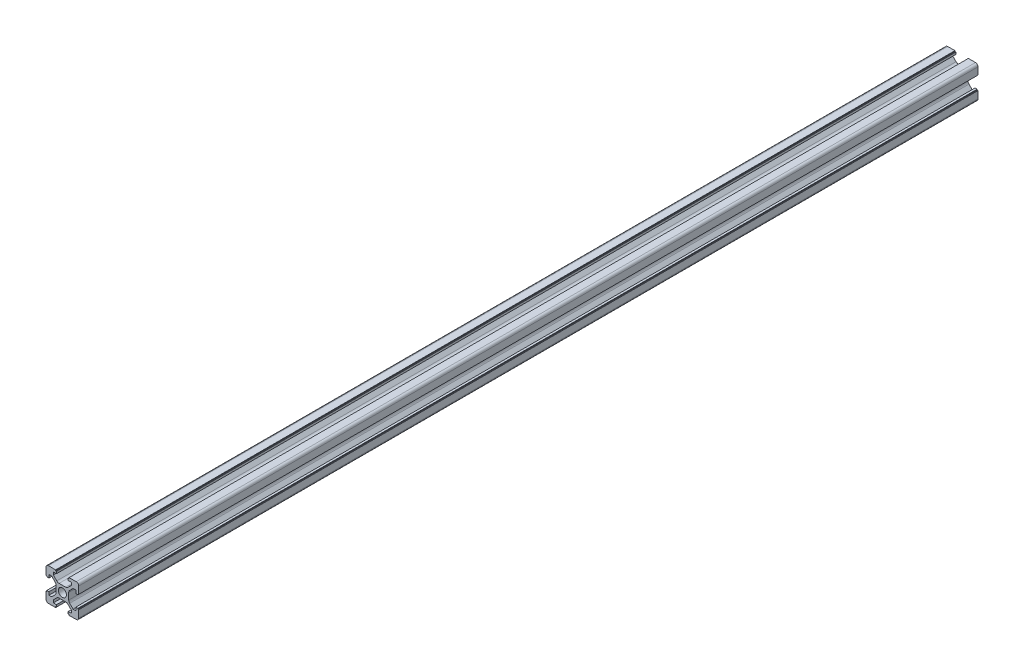
from build123d import *

# Parameters (mm, degrees)
SKETCH1_R           = 2.5
BOSS_EXTRUDE2_DEPTH = 550


with BuildPart() as part:
    # Sketch1 → Boss-Extrude2 (new body)
    with BuildSketch(Plane.XY):
        with BuildLine():
            Line((10, -4.1), (10, -8.5))
            ThreePointArc((10, -8.5), (9.560660172, -9.560660172), (8.5, -10))
            Line((8.5, -10), (4.1, -10))
            Line((4.1, -10), (4.1, -9.5))
            Line((4.1, -9.5), (3.6, -9.5))
            Line((3.6, -9.5), (3.6, -8.2))
            Line((3.6, -8.2), (5.5, -8.2))
            Line((5.5, -8.2), (5.5, -6.560660172))
            Line((5.5, -6.560660172), (3.425126266, -4.485786438))
            ThreePointArc((3.425126266, -4.485786438), (2.776279568, -4.052240935), (2.010912703, -3.9))
            Line((2.010912703, -3.9), (-2.010912703, -3.9))
            ThreePointArc((-2.010912703, -3.9), (-2.776279568, -4.052240935), (-3.425126266, -4.485786438))
            Line((-3.425126266, -4.485786438), (-5.5, -6.560660172))
            Line((-5.5, -6.560660172), (-5.5, -8.2))
            Line((-5.5, -8.2), (-3.6, -8.2))
            Line((-3.6, -8.2), (-3.6, -9.5))
            Line((-3.6, -9.5), (-4.1, -9.5))
            Line((-4.1, -9.5), (-4.1, -10))
            Line((-4.1, -10), (-8.5, -10))
            ThreePointArc((-8.5, -10), (-9.560660172, -9.560660172), (-10, -8.5))
            Line((-10, -8.5), (-10, -4.1))
            Line((-10, -4.1), (-9.5, -4.1))
            Line((-9.5, -4.1), (-9.5, -3.6))
            Line((-9.5, -3.6), (-8.2, -3.6))
            Line((-8.2, -3.6), (-8.2, -5.5))
            Line((-8.2, -5.5), (-6.560660172, -5.5))
            Line((-6.560660172, -5.5), (-4.485786438, -3.425126266))
            ThreePointArc((-4.485786438, -3.425126266), (-4.052240935, -2.776279568), (-3.9, -2.010912703))
            Line((-3.9, -2.010912703), (-3.9, 2.010912703))
            ThreePointArc((-3.9, 2.010912703), (-4.052240935, 2.776279568), (-4.485786438, 3.425126266))
            Line((-4.485786438, 3.425126266), (-6.560660172, 5.5))
            Line((-6.560660172, 5.5), (-8.2, 5.5))
            Line((-8.2, 5.5), (-8.2, 3.6))
            Line((-8.2, 3.6), (-9.5, 3.6))
            Line((-9.5, 3.6), (-9.5, 4.1))
            Line((-9.5, 4.1), (-10, 4.1))
            Line((-10, 4.1), (-10, 8.5))
            ThreePointArc((-10, 8.5), (-9.560660172, 9.560660172), (-8.5, 10))
            Line((-8.5, 10), (-4.1, 10))
            Line((-4.1, 10), (-4.1, 9.5))
            Line((-4.1, 9.5), (-3.6, 9.5))
            Line((-3.6, 9.5), (-3.6, 8.2))
            Line((-3.6, 8.2), (-5.5, 8.2))
            Line((-5.5, 8.2), (-5.5, 6.560660172))
            Line((-5.5, 6.560660172), (-3.425126266, 4.485786438))
            ThreePointArc((-3.425126266, 4.485786438), (-2.776279568, 4.052240935), (-2.010912703, 3.9))
            Line((-2.010912703, 3.9), (2.010912703, 3.9))
            ThreePointArc((2.010912703, 3.9), (2.776279568, 4.052240935), (3.425126266, 4.485786438))
            Line((3.425126266, 4.485786438), (5.5, 6.560660172))
            Line((5.5, 6.560660172), (5.5, 8.2))
            Line((5.5, 8.2), (3.6, 8.2))
            Line((3.6, 8.2), (3.6, 9.5))
            Line((3.6, 9.5), (4.1, 9.5))
            Line((4.1, 9.5), (4.1, 10))
            Line((4.1, 10), (8.5, 10))
            ThreePointArc((8.5, 10), (9.560660172, 9.560660172), (10, 8.5))
            Line((10, 8.5), (10, 4.1))
            Line((10, 4.1), (9.5, 4.1))
            Line((9.5, 4.1), (9.5, 3.6))
            Line((9.5, 3.6), (8.2, 3.6))
            Line((8.2, 3.6), (8.2, 5.5))
            Line((8.2, 5.5), (6.560660172, 5.5))
            Line((6.560660172, 5.5), (4.485786438, 3.425126266))
            ThreePointArc((4.485786438, 3.425126266), (4.052240935, 2.776279568), (3.9, 2.010912703))
            Line((3.9, 2.010912703), (3.9, -2.010912703))
            ThreePointArc((3.9, -2.010912703), (4.052240935, -2.776279568), (4.485786438, -3.425126266))
            Line((4.485786438, -3.425126266), (6.560660172, -5.5))
            Line((6.560660172, -5.5), (8.2, -5.5))
            Line((8.2, -5.5), (8.2, -3.6))
            Line((8.2, -3.6), (9.5, -3.6))
            Line((9.5, -3.6), (9.5, -4.1))
            Line((9.5, -4.1), (10, -4.1))
        make_face()
        Circle(SKETCH1_R, mode=Mode.SUBTRACT)
    extrude(amount=BOSS_EXTRUDE2_DEPTH)


solid = part.part
